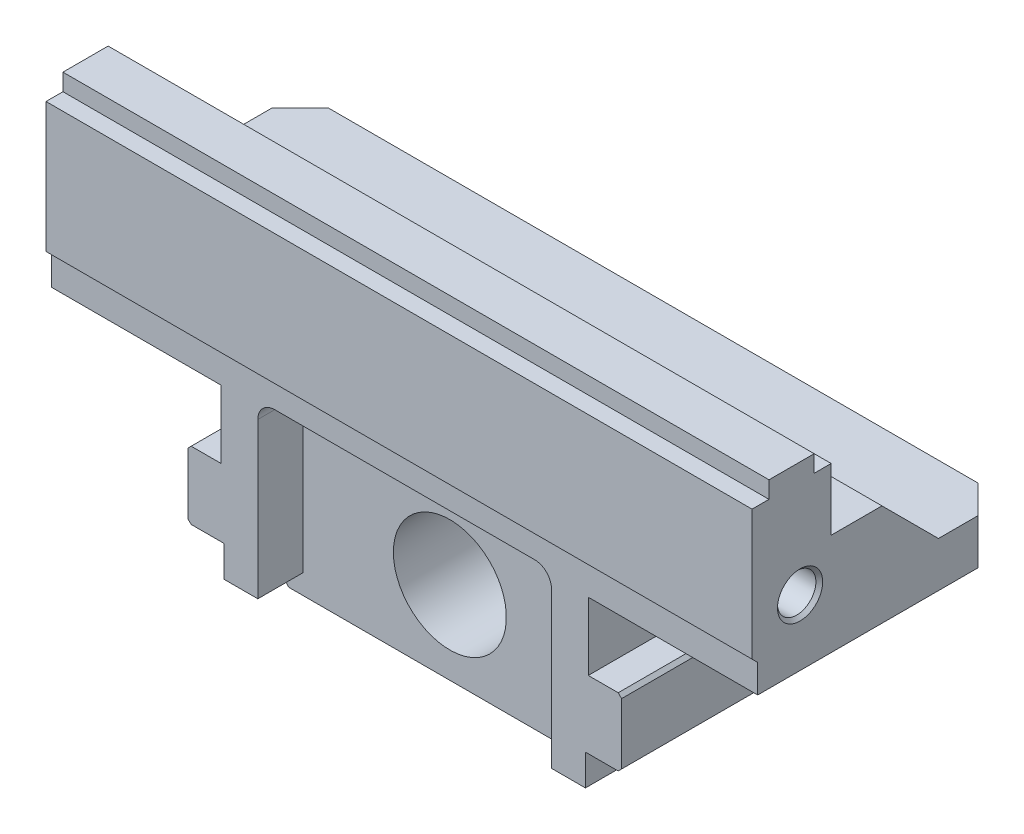
from build123d import *

# Parameters (mm, degrees)
SKETCH1_W                      = 125
SKETCH1_H                      = 65
BOSS_EXTRUDE1_DEPTH            = 47
CUT_EXTRUDE1_DEPTH             = 156.312588028
SKETCH3_W                      = 30
SKETCH3_H                      = 33
CUT_EXTRUDE2_DEPTH             = 119.474680839
SKETCH4_W                      = 46
SKETCH4_H                      = 21
BOSS_EXTRUDE2_DEPTH            = 5.9
SKETCH5_W                      = 30
SKETCH5_H                      = 33
CUT_EXTRUDE3_DEPTH             = 119.474680839
SKETCH6_W                      = 46
SKETCH6_H                      = 21
BOSS_EXTRUDE3_DEPTH            = 5.9
SKETCH7_W                      = 6.4
SKETCH7_H                      = 9
CUT_EXTRUDE4_DEPTH             = 119.081539624
SKETCH8_W                      = 6.4
SKETCH8_H                      = 9
CUT_EXTRUDE5_DEPTH             = 119.081539624
SKETCH9_W                      = 8
SKETCH9_H                      = 3.5
CUT_EXTRUDE6_DEPTH             = 133.012310032
SKETCH10_W                     = 52
SKETCH10_H                     = 30.5
CUT_EXTRUDE7_DEPTH             = 8
SKETCH11_W                     = 8
SKETCH11_H                     = 3.5
CUT_EXTRUDE8_DEPTH             = 133.012310032
SKETCH12_W                     = 52
SKETCH12_H                     = 30.5
CUT_EXTRUDE9_DEPTH             = 8
SKETCH13_W                     = 33
SKETCH13_H                     = 14
CUT_EXTRUDE10_DEPTH            = 156.312588028
CUT_EXTRUDE11_DEPTH            = 156.312588028
SKETCH15_W                     = 3
SKETCH15_H                     = 3
CUT_EXTRUDE12_DEPTH            = 156.312588028
SKETCH16_W                     = 3
SKETCH16_H                     = 3
CUT_EXTRUDE13_DEPTH            = 156.312588028
F_6_8_6_8_DIAMETER_HOLE1_D     = 6.8
F_6_8_6_8_DIAMETER_HOLE1_DEPTH = 22
F_6_8_6_8_DIAMETER_HOLE1_TIP   = 2.042926105
F_6_8_6_8_DIAMETER_HOLE2_D     = 6.8
F_6_8_6_8_DIAMETER_HOLE2_DEPTH = 22
F_6_8_6_8_DIAMETER_HOLE2_TIP   = 2.042926105
F_20_0_20_DIAMETER_HOLE1_D     = 20
F_20_0_20_DIAMETER_HOLE1_DEPTH = 39
CHAMFER1_SIZE                  = 0.6
CHAMFER2_SIZE                  = 2
CHAMFER3_SIZE                  = 3.5
CHAMFER4_SIZE                  = 7
FILLET1_R                      = 3


with BuildPart() as part:
    # Sketch1 → Boss-Extrude1 (new body)
    with BuildSketch(Plane(origin=(0, 0, -23), x_dir=(-1, 0, 0), z_dir=(0, 0, -1))):
        with Locations((0, 56.5)):
            Rectangle(SKETCH1_W, SKETCH1_H)
    extrude(amount=-BOSS_EXTRUDE1_DEPTH)

    # Sketch2 → Cut-Extrude1 (cut, through all)
    with BuildSketch(Plane.ZY.offset(62.5)):
        Polygon((24, 24), (24, 63), (23, 62), (23, 24), align=None)
    extrude(amount=-CUT_EXTRUDE1_DEPTH, mode=Mode.SUBTRACT)

    # Sketch3 → Cut-Extrude2 (cut, through all)
    with BuildSketch(Plane(origin=(0, 0, -23), x_dir=(-1, 0, 0), z_dir=(0, 0, -1))):
        with Locations((47.5, 40.5)):
            Rectangle(SKETCH3_W, SKETCH3_H)
    extrude(amount=-CUT_EXTRUDE2_DEPTH, mode=Mode.SUBTRACT)

    # Sketch4 → Boss-Extrude2 (add)
    with BuildSketch(Plane.ZY.offset(32.5)):
        with Locations((0, 34.5)):
            Rectangle(SKETCH4_W, SKETCH4_H)
    extrude(amount=BOSS_EXTRUDE2_DEPTH)

    # Sketch5 → Cut-Extrude3 (cut, through all)
    with BuildSketch(Plane(origin=(0, 0, -23), x_dir=(-1, 0, 0), z_dir=(0, 0, -1))):
        with Locations((-47.5, 40.5)):
            Rectangle(SKETCH5_W, SKETCH5_H)
    extrude(amount=-CUT_EXTRUDE3_DEPTH, mode=Mode.SUBTRACT)

    # Sketch6 → Boss-Extrude3 (add)
    with BuildSketch(Plane(origin=(32.5, 0, 0), x_dir=(0, 0, -1), z_dir=(1, 0, 0))):
        with Locations((0, 34.5)):
            Rectangle(SKETCH6_W, SKETCH6_H)
    extrude(amount=BOSS_EXTRUDE3_DEPTH)

    # Sketch7 → Cut-Extrude4 (cut, through all)
    with BuildSketch(Plane.XY.offset(23)):
        with Locations((35.2, 28.5)):
            Rectangle(SKETCH7_W, SKETCH7_H)
    extrude(amount=-CUT_EXTRUDE4_DEPTH, mode=Mode.SUBTRACT)

    # Sketch8 → Cut-Extrude5 (cut, through all)
    with BuildSketch(Plane.XY.offset(23)):
        with Locations((-35.2, 28.5)):
            Rectangle(SKETCH8_W, SKETCH8_H)
    extrude(amount=-CUT_EXTRUDE5_DEPTH, mode=Mode.SUBTRACT)

    # Sketch9 → Cut-Extrude6 (cut, through all)
    with BuildSketch(Plane(origin=(32, 0, 0), x_dir=(0, 0, -1), z_dir=(1, 0, 0))):
        with Locations((-19, 25.75)):
            Rectangle(SKETCH9_W, SKETCH9_H)
    extrude(amount=-CUT_EXTRUDE6_DEPTH, mode=Mode.SUBTRACT)

    # Sketch10 → Cut-Extrude7 (cut)
    with BuildSketch(Plane.XY.offset(23)):
        with Locations((0, 42.75)):
            Rectangle(SKETCH10_W, SKETCH10_H)
    extrude(amount=-CUT_EXTRUDE7_DEPTH, mode=Mode.SUBTRACT)

    # Sketch11 → Cut-Extrude8 (cut, through all)
    with BuildSketch(Plane(origin=(32, 0, 0), x_dir=(0, 0, -1), z_dir=(1, 0, 0))):
        with Locations((19, 25.75)):
            Rectangle(SKETCH11_W, SKETCH11_H)
    extrude(amount=-CUT_EXTRUDE8_DEPTH, mode=Mode.SUBTRACT)

    # Sketch12 → Cut-Extrude9 (cut)
    with BuildSketch(Plane(origin=(0, 0, -23), x_dir=(-1, 0, 0), z_dir=(0, 0, -1))):
        with Locations((0, 42.75)):
            Rectangle(SKETCH12_W, SKETCH12_H)
    extrude(amount=-CUT_EXTRUDE9_DEPTH, mode=Mode.SUBTRACT)

    # Sketch13 → Cut-Extrude10 (cut, through all)
    with BuildSketch(Plane.ZY.offset(62.5)):
        with Locations((-6.5, 82)):
            Rectangle(SKETCH13_W, SKETCH13_H)
    extrude(amount=-CUT_EXTRUDE10_DEPTH, mode=Mode.SUBTRACT)

    # Sketch14 → Cut-Extrude11 (cut, through all)
    with BuildSketch(Plane.ZY.offset(62.5)):
        Polygon((-23, 75), (-23, 65), (-9, 65), (1, 75), align=None)
    extrude(amount=-CUT_EXTRUDE11_DEPTH, mode=Mode.SUBTRACT)

    # Sketch15 → Cut-Extrude12 (cut, through all)
    with BuildSketch(Plane.ZY.offset(62.5)):
        with Locations((11.5, 87.5)):
            Rectangle(SKETCH15_W, SKETCH15_H)
    extrude(amount=-CUT_EXTRUDE12_DEPTH, mode=Mode.SUBTRACT)

    # Sketch16 → Cut-Extrude13 (cut, through all)
    with BuildSketch(Plane.ZY.offset(62.5)):
        with Locations((22.5, 87.5)):
            Rectangle(SKETCH16_W, SKETCH16_H)
    extrude(amount=-CUT_EXTRUDE13_DEPTH, mode=Mode.SUBTRACT)

    # Ø6.8 (6.8) Diameter Hole1
    with Locations(Plane.ZY.offset(62.5)):
        with Locations((15.5, 68.6)):
            Hole(F_6_8_6_8_DIAMETER_HOLE1_D / 2, depth=F_6_8_6_8_DIAMETER_HOLE1_DEPTH)
            with Locations((0, 0, -(F_6_8_6_8_DIAMETER_HOLE1_DEPTH + F_6_8_6_8_DIAMETER_HOLE1_TIP / 2))):  # 118° drill point
                Cone(0, F_6_8_6_8_DIAMETER_HOLE1_D / 2, F_6_8_6_8_DIAMETER_HOLE1_TIP, mode=Mode.SUBTRACT)

    # Ø6.8 (6.8) Diameter Hole2
    with Locations(Plane(origin=(62.5, 0, 0), x_dir=(0, 0, -1), z_dir=(1, 0, 0))):
        with Locations((-15.5, 68.6)):
            Hole(F_6_8_6_8_DIAMETER_HOLE2_D / 2, depth=F_6_8_6_8_DIAMETER_HOLE2_DEPTH)
            with Locations((0, 0, -(F_6_8_6_8_DIAMETER_HOLE2_DEPTH + F_6_8_6_8_DIAMETER_HOLE2_TIP / 2))):  # 118° drill point
                Cone(0, F_6_8_6_8_DIAMETER_HOLE2_D / 2, F_6_8_6_8_DIAMETER_HOLE2_TIP, mode=Mode.SUBTRACT)

    # Ø20.0 (20) Diameter Hole1
    with Locations(Plane(origin=(0, 0, -15), x_dir=(-1, 0, 0), z_dir=(0, 0, -1))):
        with Locations((0, 38.65)):
            Hole(F_20_0_20_DIAMETER_HOLE1_D / 2, depth=F_20_0_20_DIAMETER_HOLE1_DEPTH)

    # Chamfer1
    chamfer1_edges = [part.edges().sort_by_distance(p)[0] for p in [
        (38.4, 33, 0),
        (-38.4, 33, 0),
        (-62.5, 68.6, 18.9),
        (62.5, 68.6, 12.1),
        (-38.4, 45, 0),
        (38.4, 45, 0),
    ]]
    chamfer(chamfer1_edges, length=CHAMFER1_SIZE)

    # Chamfer2
    chamfer2_edges = [part.edges().sort_by_distance(p)[0] for p in [
        (0, 65, -23),
    ]]
    chamfer(chamfer2_edges, length=CHAMFER2_SIZE)

    # Chamfer3
    chamfer3_edges = [part.edges().sort_by_distance(p)[0] for p in [
        (32, 24, 0),
        (-32, 24, 0),
    ]]
    chamfer(chamfer3_edges, length=CHAMFER3_SIZE)

    # Chamfer4
    chamfer4_edges = [part.edges().sort_by_distance(p)[0] for p in [
        (-62.5, 60, -23),
        (62.5, 60, -23),
    ]]
    chamfer(chamfer4_edges, length=CHAMFER4_SIZE)

    # Fillet1
    fillet1_edges = [part.edges().sort_by_distance(p)[0] for p in [
        (-26, 58, 19),
        (26, 58, 19),
        (-26, 58, -19),
        (26, 58, -19),
    ]]
    fillet(fillet1_edges, radius=FILLET1_R)


solid = part.part
